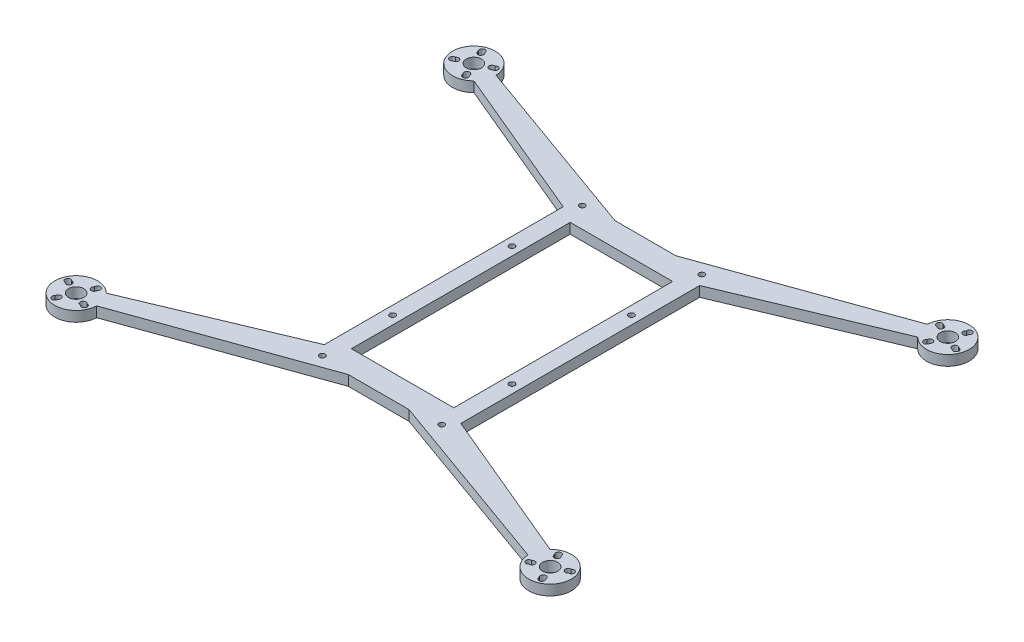
from build123d import *

# Parameters (mm, degrees)
SKETCH_1_W          = 60
SKETCH_1_H          = 128.259005876
EXTRUDE_1_DEPTH     = 3
SKETCH_2_R          = 4.5
CUT_EXTRUDE_1_DEPTH = 200.027899546
SKETCH_3_R          = 1.65
CUT_EXTRUDE_2_DEPTH = 200.027899546


with BuildPart() as part:
    # Эскиз1 → Бобышка-Вытянуть1 (new, symmetric)
    with BuildSketch(Plane(origin=(0, 0, 0), x_dir=(1, 0, 0), z_dir=(0, 1, 0))):
        with BuildLine():
            Line((-17.777747069, 78.129502938), (17.777747069, 78.129502938))
            Line((17.777747069, 78.129502938), (126.410491497, 117.062971345))
            ThreePointArc((126.410491497, 117.062971345), (150.551636651, 121.077456566), (130.031705733, 107.741662024))
            Line((130.031705733, 107.741662024), (40, 70))
            Line((40, 70), (40, -70))
            Line((40, -70), (130.031705733, -107.741662024))
            ThreePointArc((130.031705733, -107.741662024), (150.551636651, -121.077456566), (126.410491497, -117.062971345))
            Line((126.410491497, -117.062971345), (17.777747069, -78.129502938))
            Line((17.777747069, -78.129502938), (-17.777747069, -78.129502938))
            Line((-17.777747069, -78.129502938), (-126.410491497, -117.062971345))
            ThreePointArc((-126.410491497, -117.062971345), (-150.551636651, -121.077456566), (-130.031705733, -107.741662024))
            Line((-130.031705733, -107.741662024), (-40, -70))
            Line((-40, -70), (-40, 70))
            Line((-40, 70), (-130.031705733, 107.741662024))
            ThreePointArc((-130.031705733, 107.741662024), (-150.551636651, 121.077456566), (-126.410491497, 117.062971345))
            Line((-126.410491497, 117.062971345), (-17.777747069, 78.129502938))
        make_face()
        Rectangle(SKETCH_1_W, SKETCH_1_H, mode=Mode.SUBTRACT)
    extrude(amount=EXTRUDE_1_DEPTH, both=True)

    # Эскиз2 → Вырез-Вытянуть1 (cut, through all)
    with BuildSketch(Plane(origin=(0, 3, 0), x_dir=(1, 0, 0), z_dir=(0, 1, 0))):
        with Locations(Location((-138.9, 116.550938771, 0), (0, 0, 270))):
            Circle(SKETCH_2_R)
        with Locations(Location((138.9, 116.550938771, 0), (0, 0, 90))):
            Circle(SKETCH_2_R)
        with Locations(Location((138.9, -116.550938771, 0), (0, 0, 270))):
            Circle(SKETCH_2_R)
        with Locations(Location((-138.9, -116.550938771, 0), (0, 0, 90))):
            Circle(SKETCH_2_R)
        with BuildLine():
            ThreePointArc((-141.081727399, 125.151087929), (-143.394092115, 126.755135753), (-143.771780405, 123.966345414))
            ThreePointArc((-143.771780405, 123.966345414), (-141.459415689, 122.36229759), (-141.081727399, 125.151087929))
        make_face()
        with BuildLine():
            ThreePointArc((-130.299850841, 118.73266617), (-128.695803017, 121.045030885), (-131.484593356, 121.422719175))
            ThreePointArc((-131.484593356, 121.422719175), (-133.08864118, 119.110354459), (-130.299850841, 118.73266617))
        make_face()
        with BuildLine():
            ThreePointArc((-136.718272601, 107.950789612), (-134.405907885, 106.346741788), (-134.028219595, 109.135532127))
            ThreePointArc((-134.028219595, 109.135532127), (-136.340584311, 110.739579951), (-136.718272601, 107.950789612))
        make_face()
        with BuildLine():
            ThreePointArc((-147.500149159, 114.369211371), (-149.104196983, 112.056846656), (-146.315406644, 111.679158366))
            ThreePointArc((-146.315406644, 111.679158366), (-144.71135882, 113.991523082), (-147.500149159, 114.369211371))
        make_face()
        with BuildLine():
            ThreePointArc((146.315406644, 111.679158366), (144.71135882, 113.991523082), (147.500149159, 114.369211371))
            ThreePointArc((147.500149159, 114.369211371), (149.104196983, 112.056846656), (146.315406644, 111.679158366))
        make_face()
        with BuildLine():
            ThreePointArc((134.028219595, 109.135532127), (136.340584311, 110.739579951), (136.718272601, 107.950789612))
            ThreePointArc((136.718272601, 107.950789612), (134.405907885, 106.346741788), (134.028219595, 109.135532127))
        make_face()
        with BuildLine():
            ThreePointArc((131.484593356, 121.422719175), (133.08864118, 119.110354459), (130.299850841, 118.73266617))
            ThreePointArc((130.299850841, 118.73266617), (128.695803017, 121.045030885), (131.484593356, 121.422719175))
        make_face()
        with BuildLine():
            ThreePointArc((143.771780405, 123.966345414), (141.459415689, 122.36229759), (141.081727399, 125.151087929))
            ThreePointArc((141.081727399, 125.151087929), (143.394092115, 126.755135753), (143.771780405, 123.966345414))
        make_face()
        with BuildLine():
            ThreePointArc((141.081727399, -125.151087929), (143.394092115, -126.755135753), (143.771780405, -123.966345414))
            ThreePointArc((143.771780405, -123.966345414), (141.459415689, -122.36229759), (141.081727399, -125.151087929))
        make_face()
        with BuildLine():
            ThreePointArc((130.299850841, -118.73266617), (128.695803017, -121.045030885), (131.484593356, -121.422719175))
            ThreePointArc((131.484593356, -121.422719175), (133.08864118, -119.110354459), (130.299850841, -118.73266617))
        make_face()
        with BuildLine():
            ThreePointArc((136.718272601, -107.950789612), (134.405907885, -106.346741788), (134.028219595, -109.135532127))
            ThreePointArc((134.028219595, -109.135532127), (136.340584311, -110.739579951), (136.718272601, -107.950789612))
        make_face()
        with BuildLine():
            ThreePointArc((147.500149159, -114.369211371), (149.104196983, -112.056846656), (146.315406644, -111.679158366))
            ThreePointArc((146.315406644, -111.679158366), (144.71135882, -113.991523082), (147.500149159, -114.369211371))
        make_face()
        with BuildLine():
            ThreePointArc((-146.315406644, -111.679158366), (-144.71135882, -113.991523082), (-147.500149159, -114.369211371))
            ThreePointArc((-147.500149159, -114.369211371), (-149.104196983, -112.056846656), (-146.315406644, -111.679158366))
        make_face()
        with BuildLine():
            ThreePointArc((-134.028219595, -109.135532127), (-136.340584311, -110.739579951), (-136.718272601, -107.950789612))
            ThreePointArc((-136.718272601, -107.950789612), (-134.405907885, -106.346741788), (-134.028219595, -109.135532127))
        make_face()
        with BuildLine():
            ThreePointArc((-131.484593356, -121.422719175), (-133.08864118, -119.110354459), (-130.299850841, -118.73266617))
            ThreePointArc((-130.299850841, -118.73266617), (-128.695803017, -121.045030885), (-131.484593356, -121.422719175))
        make_face()
        with BuildLine():
            ThreePointArc((-143.771780405, -123.966345414), (-141.459415689, -122.36229759), (-141.081727399, -125.151087929))
            ThreePointArc((-141.081727399, -125.151087929), (-143.394092115, -126.755135753), (-143.771780405, -123.966345414))
        make_face()
    extrude(amount=-CUT_EXTRUDE_1_DEPTH, mode=Mode.SUBTRACT)

    # Эскиз3 → Вырез-Вытянуть2 (cut, through all)
    with BuildSketch(Plane(origin=(0, 3, 0), x_dir=(1, 0, 0), z_dir=(0, 1, 0))):
        with Locations(Location((-35, 76.19, 0), (0, 0, 270))):
            Circle(SKETCH_3_R)
        with Locations(Location((-35, 35, 0), (0, 0, 270))):
            Circle(SKETCH_3_R)
        with Locations(Location((-35, -35, 0), (0, 0, 90))):
            Circle(SKETCH_3_R)
        with Locations(Location((-35, -76.19, 0), (0, 0, 90))):
            Circle(SKETCH_3_R)
        with Locations(Location((35, -76.19, 0), (0, 0, 270))):
            Circle(SKETCH_3_R)
        with Locations(Location((35, -35, 0), (0, 0, 270))):
            Circle(SKETCH_3_R)
        with Locations(Location((35, 35, 0), (0, 0, 90))):
            Circle(SKETCH_3_R)
        with Locations(Location((35, 76.19, 0), (0, 0, 90))):
            Circle(SKETCH_3_R)
    extrude(amount=-CUT_EXTRUDE_2_DEPTH, mode=Mode.SUBTRACT)


solid = part.part
